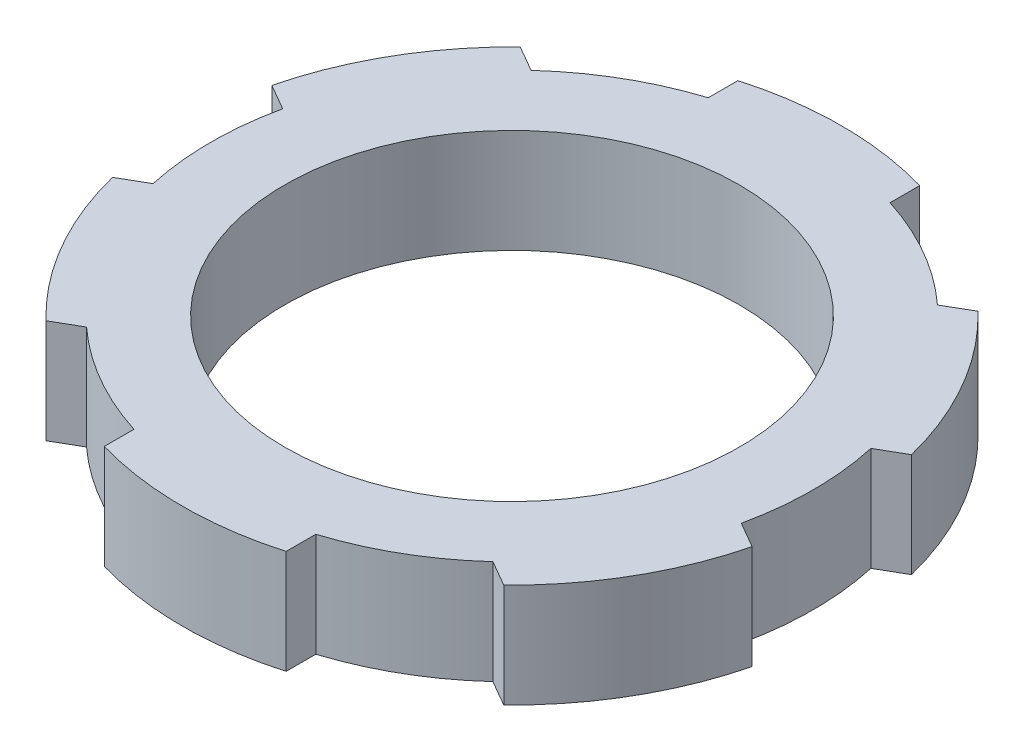
from build123d import *

# Parameters (mm, degrees)
SKETCH1_R           = 13.25
SKETCH1_R_2         = 10
BOSS_EXTRUDE1_DEPTH = 4.572
BOSS_EXTRUDE2_START = -4.572
BOSS_EXTRUDE2_DEPTH = 4.572
CIRPATTERN1_COUNT   = 6


with BuildPart() as part:
    # Sketch1 → Boss-Extrude1 (new body)
    with BuildSketch(Plane(origin=(0, 0, 0), x_dir=(1, 0, 0), z_dir=(0, 1, 0))):
        with Locations(Location((0, 0, 0), (0, 0, 270))):
            Circle(SKETCH1_R)
        with Locations(Location((0, 0, 0), (0, 0, 270))):
            Circle(SKETCH1_R_2, mode=Mode.SUBTRACT)
    extrude(amount=BOSS_EXTRUDE1_DEPTH)

    # Sketch2 → Boss-Extrude2 (add)
    with BuildSketch(Plane(origin=(0, 4.572, 0), x_dir=(1, 0, 0), z_dir=(0, 1, 0)).offset(BOSS_EXTRUDE2_START)):
        with BuildLine():
            Line((-4, 12.631805097), (-4, 13.937359865))
            ThreePointArc((-4, 13.937359865), (0, 14.5), (4, 13.937359865))
            Line((4, 13.937359865), (4, 12.631805097))
            ThreePointArc((4, 12.631805097), (0, 13.25), (-4, 12.631805097))
        make_face()
    boss_extrude2 = extrude(amount=BOSS_EXTRUDE2_DEPTH)

    # CirPattern1: Boss-Extrude2 ×6 about axis
    cirpattern1_axis = Axis((0, 0, 0), (0, 1, 0))
    for i in range(1, CIRPATTERN1_COUNT):
        add(boss_extrude2.rotate(cirpattern1_axis, i * 360 / CIRPATTERN1_COUNT))


solid = part.part
